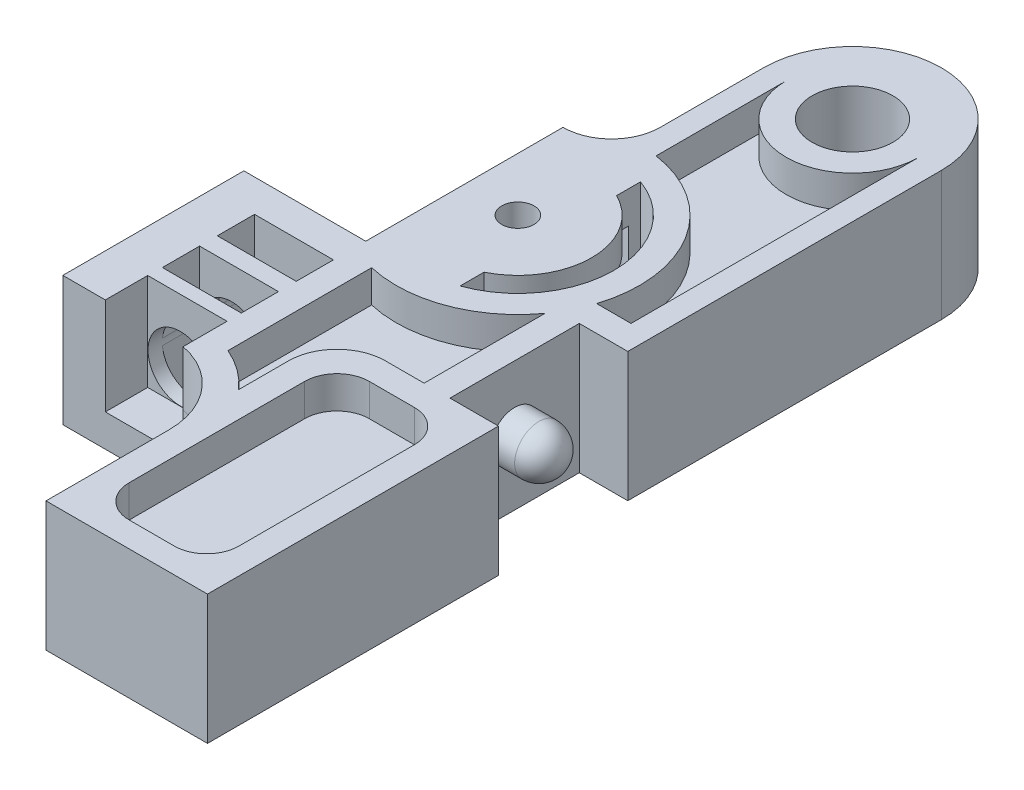
from build123d import *

# Parameters (mm, degrees)
SKETCH1_W           = 21.55
SKETCH1_H           = 50.9
BOSS_EXTRUDE1_DEPTH = 8
SKETCH2_W           = 3
SKETCH2_H           = 8
SKETCH2_W_2         = 11.56
SKETCH2_H_2         = 12.6
CUT_EXTRUDE1_DEPTH  = 10
SKETCH4_R           = 1
CUT_EXTRUDE2_DEPTH  = 10
CUT_EXTRUDE3_START  = -2
SKETCH5_R           = 5.25
CUT_EXTRUDE3_DEPTH  = 4
CUT_EXTRUDE4_DEPTH  = 8
SKETCH7_R           = 2.5
CUT_EXTRUDE5_DEPTH  = 8
SKETCH8_R           = 1.5
BOSS_EXTRUDE2_DEPTH = 3
FILLET1_R           = 1.5
CUT_EXTRUDE6_REACH  = 46.674
SKETCH9_R           = 2
FILLET2_R           = 5
SKETCH10_W          = 4.879401489
SKETCH10_H          = 2.3
CUT_EXTRUDE7_DEPTH  = 8
SKETCH11_W          = 4.90836959
SKETCH11_H          = 2.717270837
CUT_EXTRUDE8_DEPTH  = 6
CUT_EXTRUDE9_DEPTH  = 2
CUT_EXTRUDE11_START = -2
CUT_EXTRUDE11_DEPTH = 2
CUT_EXTRUDE12_DEPTH = 2
FILLET3_R           = 3
FILLET4_R           = 2
CUT_EXTRUDE13_START = -2
CUT_EXTRUDE13_DEPTH = 2
SKETCH16_W          = 2
SKETCH16_H          = 3
CUT_EXTRUDE14_DEPTH = 7
BOSS_EXTRUDE3_START = -2
BOSS_EXTRUDE3_DEPTH = 2


with BuildPart() as part:
    # Sketch1 → Boss-Extrude1 (new body)
    with BuildSketch(Plane(origin=(0, 0, 0), x_dir=(1, 0, 0), z_dir=(0, 1, 0))):
        with Locations((-10.785, 25.45)):
            Rectangle(SKETCH1_W, SKETCH1_H)
    extrude(amount=BOSS_EXTRUDE1_DEPTH)

    # Sketch2 → Cut-Extrude1 (cut)
    with BuildSketch(Plane(origin=(0, 8, 0), x_dir=(1, 0, 0), z_dir=(0, 1, 0))):
        with BuildLine():
            ThreePointArc((-14.020598511, 36), (-11.891783888, 36.881783888), (-11.01, 39.010598511))
            Line((-11.01, 39.010598511), (-11.01, 45.4))
            ThreePointArc((-11.01, 45.4), (-9.399087308, 49.289087285), (-5.510000032, 50.9))
            Line((-5.510000032, 50.9), (-21.56, 50.9))
            Line((-21.56, 50.9), (-21.56, 23.8))
            Line((-21.56, 23.8), (-14.020598511, 23.8))
            Line((-14.020598511, 23.8), (-14.020598511, 36))
        make_face()
        with BuildLine():
            Line((-0.01, 50.9), (-5.510000032, 50.9))
            ThreePointArc((-5.510000032, 50.9), (-1.620912715, 49.289087308), (-0.01, 45.4))
            Line((-0.01, 45.4), (-0.01, 50.9))
        make_face()
        with Locations((-1.51, 22)):
            Rectangle(SKETCH2_W, SKETCH2_H)
        with Locations((-15.78, 6.3)):
            Rectangle(SKETCH2_W_2, SKETCH2_H_2)
    extrude(amount=-CUT_EXTRUDE1_DEPTH, mode=Mode.SUBTRACT)

    # Sketch4 → Cut-Extrude2 (cut)
    with BuildSketch(Plane(origin=(0, 8, 0), x_dir=(1, 0, 0), z_dir=(0, 1, 0))):
        with Locations(Location((-10.71, 29.9, 0), (0, 0, 270))):
            Circle(SKETCH4_R)
    extrude(amount=-CUT_EXTRUDE2_DEPTH, mode=Mode.SUBTRACT)

    # Sketch5 → Cut-Extrude3 (cut)
    with BuildSketch(Plane(origin=(0, 8, 0), x_dir=(1, 0, 0), z_dir=(0, 1, 0)).offset(CUT_EXTRUDE3_START)):
        with Locations((-10.71, 29.9)):
            Circle(SKETCH5_R)
    extrude(amount=-CUT_EXTRUDE3_DEPTH, mode=Mode.SUBTRACT)

    # Sketch6 → Cut-Extrude4 (cut)
    with BuildSketch(Plane(origin=(0, 8, 0), x_dir=(1, 0, 0), z_dir=(0, 1, 0))):
        with BuildLine():
            Line((-8.703613469, 35.482647313), (-8.703613469, 33.999886934))
            ThreePointArc((-8.703613469, 33.999886934), (-6.145500051, 29.9), (-8.703613469, 25.800113066))
            Line((-8.703613469, 25.800113066), (-8.703613469, 24.317352687))
            ThreePointArc((-8.703613469, 24.317352687), (-4.777754394, 29.9), (-8.703613469, 35.482647313))
        make_face()
    extrude(amount=-CUT_EXTRUDE4_DEPTH, mode=Mode.SUBTRACT)

    # Sketch7 → Cut-Extrude5 (cut)
    with BuildSketch(Plane(origin=(0, 8, 0), x_dir=(1, 0, 0), z_dir=(0, 1, 0))):
        with Locations(Location((-5.51, 45.4, 0), (0, 0, 270))):
            Circle(SKETCH7_R)
    extrude(amount=-CUT_EXTRUDE5_DEPTH, mode=Mode.SUBTRACT)

    # Sketch8 → Boss-Extrude2 (add)
    with BuildSketch(Plane(origin=(-3.01, 0, 0), x_dir=(0, 0, -1), z_dir=(1, 0, 0))):
        with Locations(Location((22, 4, 0), (0, 0, 180))):
            Circle(SKETCH8_R)
    extrude(amount=BOSS_EXTRUDE2_DEPTH)

    # Fillet1
    fillet1_edges = [part.edges().sort_by_distance(p)[0] for p in [
        (-0.01, 4, -23.5),
    ]]
    fillet(fillet1_edges, radius=FILLET1_R)

    # Sketch9 → Cut-Extrude6 (cut, up to next)
    with BuildSketch(Plane.XY.offset(-12.6), mode=Mode.PRIVATE) as cut_extrude6_sk1:
        with Locations((-16.91, 4.013647605)):
            Circle(SKETCH9_R)
    cut_extrude6_tool1 = extrude(cut_extrude6_sk1.sketch, amount=-CUT_EXTRUDE6_REACH, mode=Mode.PRIVATE) & part.part
    add(cut_extrude6_tool1.solids().sort_by_distance((-16.91, 4.013648, -12.6))[0], mode=Mode.SUBTRACT)

    # Fillet2
    fillet2_edges = [part.edges().sort_by_distance(p)[0] for p in [
        (-10, 4, -12.6),
    ]]
    fillet(fillet2_edges, radius=FILLET2_R)

    # Sketch10 → Cut-Extrude7 (cut)
    with BuildSketch(Plane(origin=(0, 8, 0), x_dir=(1, 0, 0), z_dir=(0, 1, 0))):
        with Locations((-16.460299256, 20.65)):
            Rectangle(SKETCH10_W, SKETCH10_H)
        with Locations((-16.460299256, 17.25)):
            Rectangle(SKETCH10_W, SKETCH10_H)
    extrude(amount=-CUT_EXTRUDE7_DEPTH, mode=Mode.SUBTRACT)

    # Sketch11 → Cut-Extrude8 (cut)
    with BuildSketch(Plane(origin=(0, 8, 0), x_dir=(1, 0, 0), z_dir=(0, 1, 0))):
        with Locations((-16.474783306, 13.861774486)):
            Rectangle(SKETCH11_W, SKETCH11_H)
    extrude(amount=-CUT_EXTRUDE8_DEPTH, mode=Mode.SUBTRACT)

    # Sketch12 → Cut-Extrude9 (cut)
    with BuildSketch(Plane(origin=(0, 8, 0), x_dir=(1, 0, 0), z_dir=(0, 1, 0))):
        with BuildLine():
            Line((-9.61, 45.4), (-9.61, 37.351491386))
            ThreePointArc((-9.61, 37.351491386), (-4.316139602, 33.881616893), (-3.537502257, 27.6))
            Line((-3.537502257, 27.6), (-1.41, 27.6))
            Line((-1.41, 27.6), (-1.41, 45.4))
            ThreePointArc((-1.41, 45.4), (-5.51, 41.3), (-9.61, 45.4))
        make_face()
    extrude(amount=-CUT_EXTRUDE9_DEPTH, mode=Mode.SUBTRACT)

    # Sketch13 → Cut-Extrude11 (cut)
    with BuildSketch(Plane.XZ.offset(CUT_EXTRUDE11_START)):
        with BuildLine():
            Line((-1.41, -27.6), (-3.537502257, -27.6))
            ThreePointArc((-3.537502257, -27.6), (-4.316139602, -33.881616893), (-9.61, -37.351491386))
            Line((-9.61, -37.351491386), (-9.61, -45.4))
            ThreePointArc((-9.61, -45.4), (-5.51, -41.3), (-1.41, -45.4))
            Line((-1.41, -45.4), (-1.41, -27.6))
        make_face()
    extrude(amount=CUT_EXTRUDE11_DEPTH, mode=Mode.SUBTRACT)

    # Sketch14 → Cut-Extrude12 (cut)
    with BuildSketch(Plane(origin=(0, 8, 0), x_dir=(1, 0, 0), z_dir=(0, 1, 0))):
        with BuildLine():
            Line((-12.420598511, 22.564567047), (-12.420598511, 13.675087486))
            ThreePointArc((-12.420598511, 13.675087486), (-11.108680842, 12.930819375), (-10, 11.908131846))
            Line((-10, 11.908131846), (-10, 18))
            Line((-10, 18), (-4.61, 18))
            Line((-4.61, 18), (-4.61, 25.481321027))
            ThreePointArc((-4.61, 25.481321027), (-8.074933625, 22.843715633), (-12.420598511, 22.564567047))
        make_face()
        with BuildLine():
            Line((-6.4, 16.4), (-3.61, 16.4))
            ThreePointArc((-3.61, 16.4), (-2.195786438, 15.814213562), (-1.61, 14.4))
            Line((-1.61, 14.4), (-1.61, 1.546839651))
            Line((-1.61, 1.546839651), (-8.4, 1.546839651))
            Line((-8.4, 1.546839651), (-8.4, 14.4))
            ThreePointArc((-8.4, 14.4), (-7.814213562, 15.814213562), (-6.4, 16.4))
        make_face()
    extrude(amount=-CUT_EXTRUDE12_DEPTH, mode=Mode.SUBTRACT)

    # Fillet3
    fillet3_edges = [part.edges().sort_by_distance(p)[0] for p in [
        (-10, 7, -18),
    ]]
    fillet(fillet3_edges, radius=FILLET3_R)

    # Fillet4
    fillet4_edges = [part.edges().sort_by_distance(p)[0] for p in [
        (-1.61, 7, -1.546839651),
        (-8.4, 7, -1.546839651),
    ]]
    fillet(fillet4_edges, radius=FILLET4_R)

    # Sketch15 → Cut-Extrude13 (cut)
    with BuildSketch(Plane(origin=(0, 0, 0), x_dir=(-1, 0, 0), z_dir=(0, -1, 0)).offset(CUT_EXTRUDE13_START)):
        with BuildLine():
            Line((6.4, 1.546839651), (3.61, 1.546839651))
            ThreePointArc((3.61, 1.546839651), (2.195786438, 2.132626089), (1.61, 3.546839651))
            Line((1.61, 3.546839651), (1.61, 14.4))
            ThreePointArc((1.61, 14.4), (2.195786438, 15.814213562), (3.61, 16.4))
            Line((3.61, 16.4), (6.4, 16.4))
            ThreePointArc((6.4, 16.4), (7.814213562, 15.814213562), (8.4, 14.4))
            Line((8.4, 14.4), (8.4, 3.546839651))
            ThreePointArc((8.4, 3.546839651), (7.814213562, 2.132626089), (6.4, 1.546839651))
        make_face()
        with BuildLine():
            Line((4.61, 18), (4.61, 25.481321027))
            ThreePointArc((4.61, 25.481321027), (8.074933625, 22.843715633), (12.420598511, 22.564567047))
            Line((12.420598511, 22.564567047), (12.420598511, 13.675087486))
            ThreePointArc((12.420598511, 13.675087486), (11.108680842, 12.930819375), (10, 11.908131846))
            Line((10, 11.908131846), (10, 15))
            ThreePointArc((10, 15), (9.121320344, 17.121320344), (7, 18))
            Line((7, 18), (4.61, 18))
        make_face()
    extrude(amount=CUT_EXTRUDE13_DEPTH, mode=Mode.SUBTRACT)

    # Sketch16 → Cut-Extrude14 (cut)
    with BuildSketch(Plane.ZY.offset(21.56)):
        with Locations((-22.8, 4)):
            Rectangle(SKETCH16_W, SKETCH16_H)
    extrude(amount=-CUT_EXTRUDE14_DEPTH, mode=Mode.SUBTRACT)

    # Sketch17 → Boss-Extrude3 (add)
    with BuildSketch(Plane(origin=(0, 0, -23.8), x_dir=(-1, 0, 0), z_dir=(0, 0, -1)).offset(BOSS_EXTRUDE3_START)):
        with BuildLine():
            Line((15.602762099, 2.5), (18.217237901, 2.5))
            ThreePointArc((18.217237901, 2.5), (16.91, 2.013647605), (15.602762099, 2.5))
        make_face()
        with BuildLine():
            Line((15.571808475, 5.5), (18.248191525, 5.5))
            ThreePointArc((18.248191525, 5.5), (16.91, 6.013647605), (15.571808475, 5.5))
        make_face()
    extrude(amount=BOSS_EXTRUDE3_DEPTH)


solid = part.part
